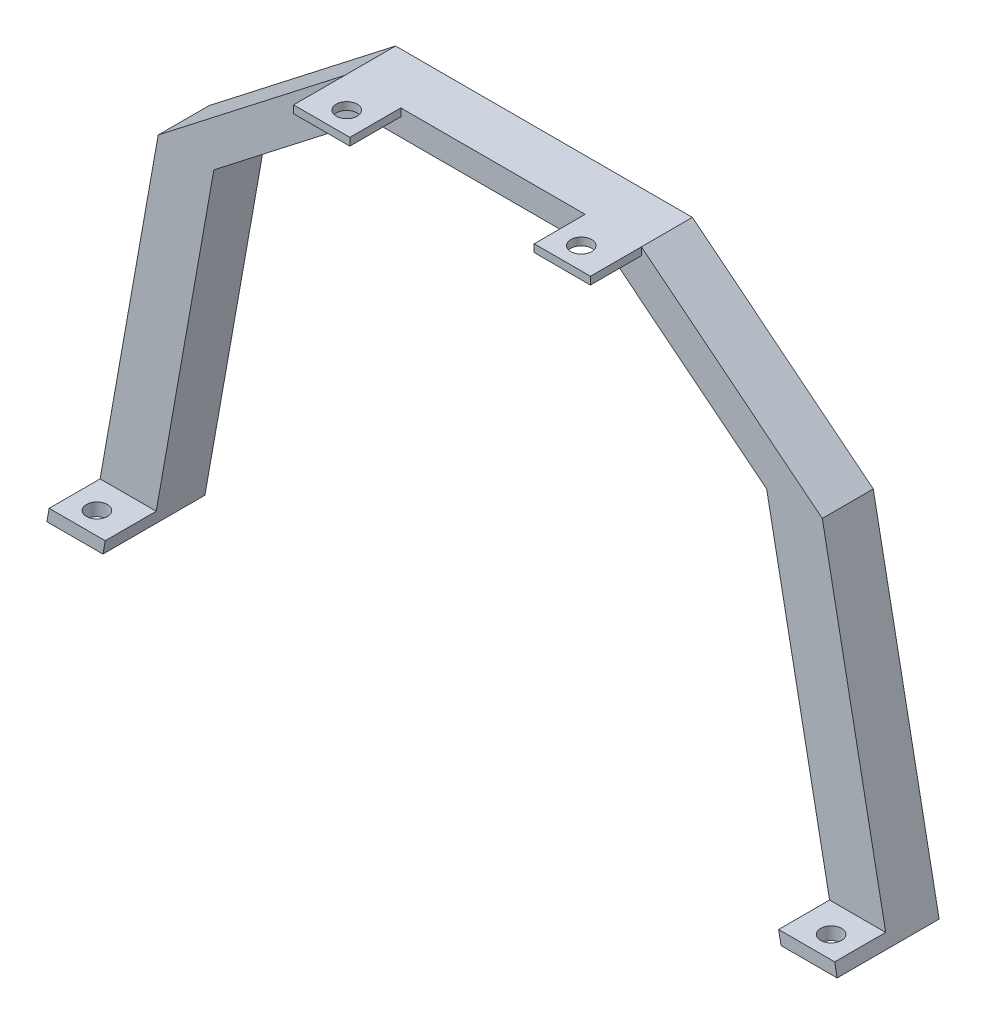
from build123d import *

# Parameters (mm, degrees)
BOSS_EXTRUDE1_DEPTH = 10
BOSS_EXTRUDE2_DEPTH = 10
SKETCH3_R           = 2.05
CUT_EXTRUDE1_DEPTH  = 10
SKETCH4_W           = 11.030190158
SKETCH4_H           = 1.5
BOSS_EXTRUDE3_DEPTH = 10
SKETCH6_R           = 2.05
CUT_EXTRUDE2_DEPTH  = 10


with BuildPart() as part:
    # Sketch1 → Boss-Extrude1 (new body)
    with BuildSketch(Plane.XY):
        Polygon((0, 0), (-11, 0), (0.829541595, 66.605292835), (37.390937938, 95), (95.609062062, 95), (131.084052408, 66.605292835), (144, 0), (133, 0), (120.17595579, 66.131363099), (90.355621362, 90), (42.478937602, 90), (11.745368532, 66.131363099), align=None)
    extrude(amount=BOSS_EXTRUDE1_DEPTH)

    # Sketch2 → Boss-Extrude2 (add)
    with BuildSketch(Plane.XY.offset(10)):
        Polygon((-11, 0), (0, 0), (0.444016575, 2.5), (-10.555983425, 2.5), align=None)
        Polygon((133, 0), (144, 0), (143.51520566, 2.5), (132.51520566, 2.5), align=None)
    extrude(amount=BOSS_EXTRUDE2_DEPTH)

    # Sketch3 → Cut-Extrude1 (cut)
    with BuildSketch(Plane(origin=(0, 2.5, 0), x_dir=(1, 0, 0), z_dir=(0, 1, 0))):
        with Locations(Location((-5.5, -15.687372709, 0), (0, 0, 180))):
            Circle(SKETCH3_R)
        with Locations(Location((138.5, -15.687372709, 0), (0, 0, 180))):
            Circle(SKETCH3_R)
    extrude(amount=-CUT_EXTRUDE1_DEPTH, mode=Mode.SUBTRACT)

    # Sketch4 → Boss-Extrude3 (add)
    with BuildSketch(Plane.XY.offset(10)):
        with Locations((42.906033017, 94.25)):
            Rectangle(SKETCH4_W, SKETCH4_H)
        with Locations((90.093966983, 94.25)):
            Rectangle(SKETCH4_W, SKETCH4_H)
    extrude(amount=BOSS_EXTRUDE3_DEPTH)

    # Sketch6 → Cut-Extrude2 (cut)
    with BuildSketch(Plane(origin=(0, 95, 0), x_dir=(1, 0, 0), z_dir=(0, 1, 0))):
        with Locations(Location((43.5, -15.687372709, 0), (0, 0, 270))):
            Circle(SKETCH6_R)
        with Locations(Location((89.5, -15.687372709, 0), (0, 0, 270))):
            Circle(SKETCH6_R)
    extrude(amount=-CUT_EXTRUDE2_DEPTH, mode=Mode.SUBTRACT)


solid = part.part
